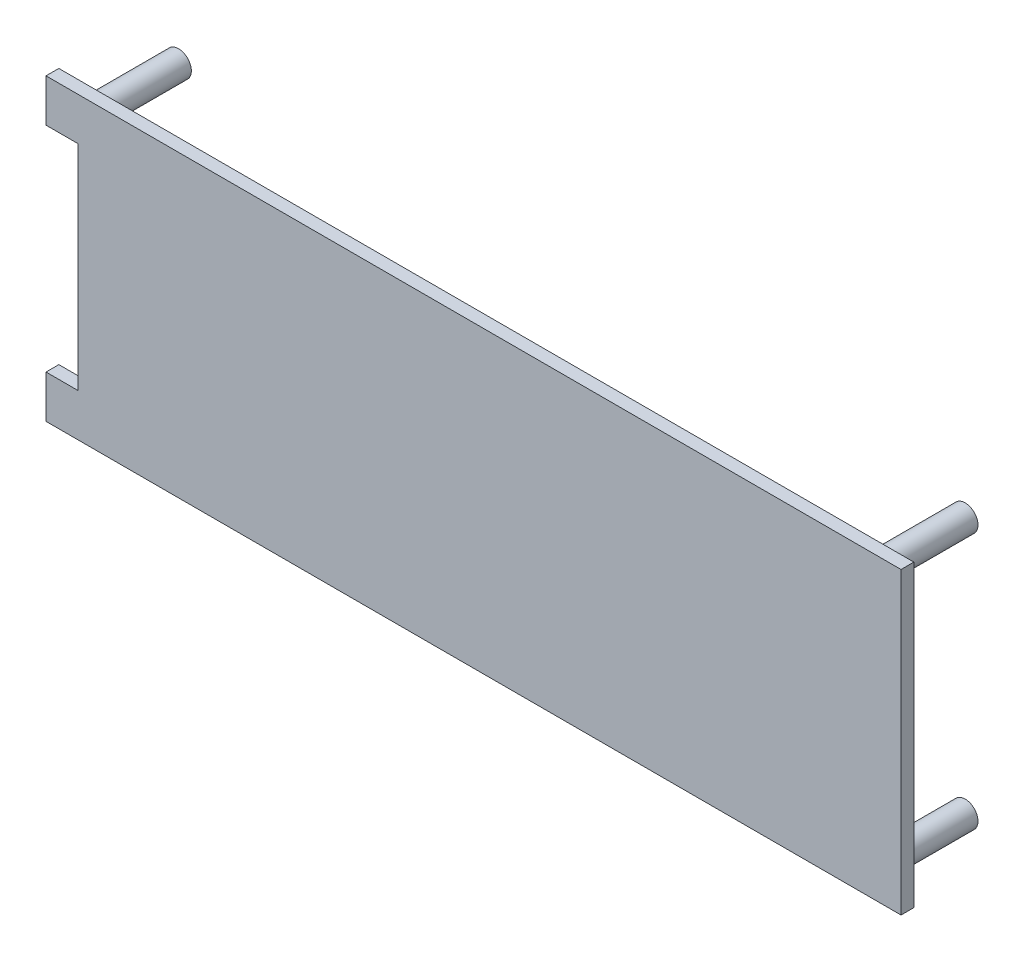
from build123d import *

# Parameters (mm, degrees)
ESBO_O2_R                  = 3
RESSALTO_EXTRUS_O1_DEPTH   = 20
RESSALTO_EXTRUS_O1_2_DEPTH = 20
RESSALTO_EXTRUS_O1_3_DEPTH = 20
RESSALTO_EXTRUS_O1_4_DEPTH = 20
ESBO_O3_W                  = 200
ESBO_O3_H                  = 70
RESSALTO_EXTRUS_O2_DEPTH   = 3
ESBO_O4_W                  = 14.89887522
ESBO_O4_H                  = 50
CORTE_EXTRUS_O1_DEPTH      = 3


with BuildPart() as part:
    # Esboço2 → Ressalto-extrusão1 (new body)
    with BuildSketch(Plane.XY):
        with Locations((192, -30)):
            Circle(ESBO_O2_R)
    extrude(amount=RESSALTO_EXTRUS_O1_DEPTH)



with BuildPart() as body_2:
    # Esboço2 → Ressalto-extrus_o1 2 (new body)
    with BuildSketch(Plane.XY):
        with Locations((192, 30)):
            Circle(ESBO_O2_R)
    extrude(amount=RESSALTO_EXTRUS_O1_2_DEPTH)


with BuildPart() as body_3:
    # Esboço2 → Ressalto-extrus_o1 3 (new body)
    with BuildSketch(Plane.XY):
        with Locations((8, 30)):
            Circle(ESBO_O2_R)
    extrude(amount=RESSALTO_EXTRUS_O1_3_DEPTH)


with BuildPart() as body_4:
    # Esboço2 → Ressalto-extrus_o1 4 (new body)
    with BuildSketch(Plane.XY):
        with Locations((8, -30)):
            Circle(ESBO_O2_R)
    extrude(amount=RESSALTO_EXTRUS_O1_4_DEPTH)


with BuildPart() as part_1:
    add(part.part)

    add(body_2.part)  # Ressalto-extrusão2 merges body 2

    add(body_3.part)  # Ressalto-extrusão2 merges body 3

    add(body_4.part)  # Ressalto-extrusão2 merges body 4
    # Esboço3 → Ressalto-extrusão2 (add)
    with BuildSketch(Plane.XY.offset(20)):
        with Locations((100, 0)):
            Rectangle(ESBO_O3_W, ESBO_O3_H)
    extrude(amount=RESSALTO_EXTRUS_O2_DEPTH)

    # Esboço4 → Corte-extrusão1 (cut)
    with BuildSketch(Plane.XY.offset(23)):
        Rectangle(ESBO_O4_W, ESBO_O4_H)
    extrude(amount=-CORTE_EXTRUS_O1_DEPTH, mode=Mode.SUBTRACT)


solid = part_1.part
